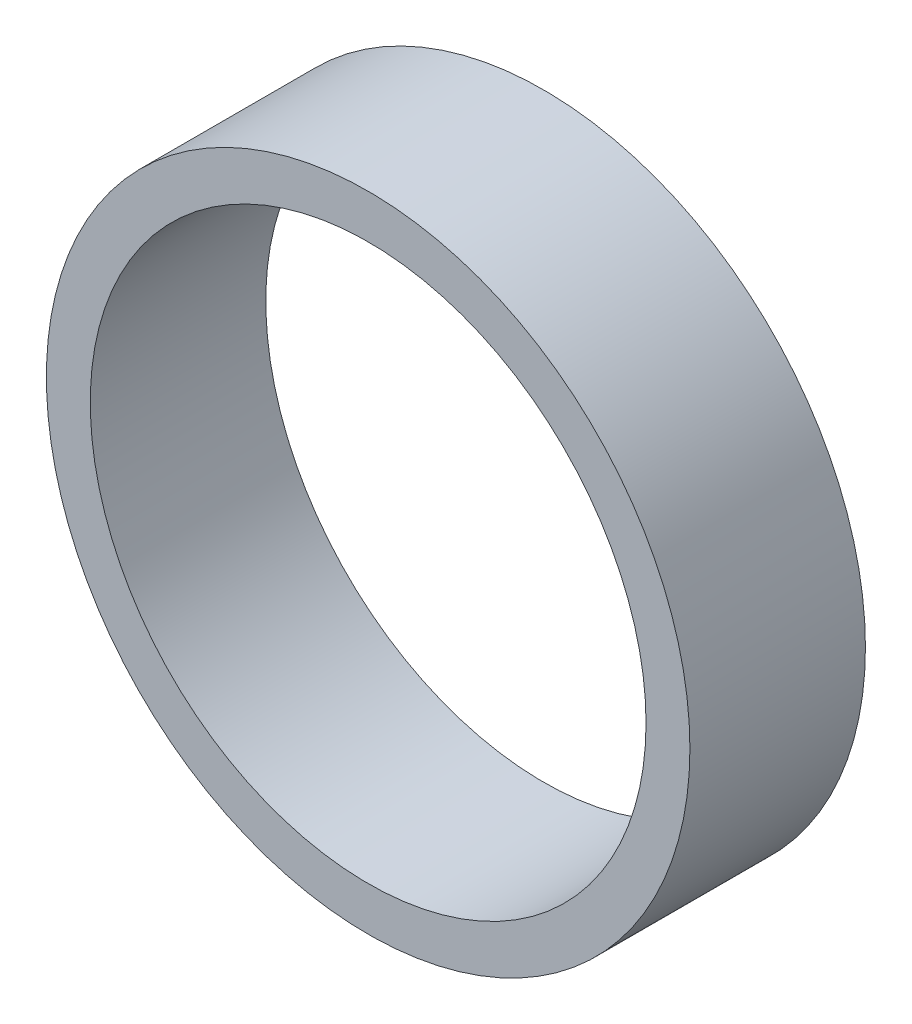
from build123d import *

# Parameters (mm, degrees)
SKETCH1_R           = 11
SKETCH1_R_2         = 9.5
BOSS_EXTRUDE1_DEPTH = 6


with BuildPart() as part:
    # Sketch1 → Boss-Extrude1 (new body)
    with BuildSketch(Plane.XY):
        Circle(SKETCH1_R)
        Circle(SKETCH1_R_2, mode=Mode.SUBTRACT)
    extrude(amount=BOSS_EXTRUDE1_DEPTH)


solid = part.part
